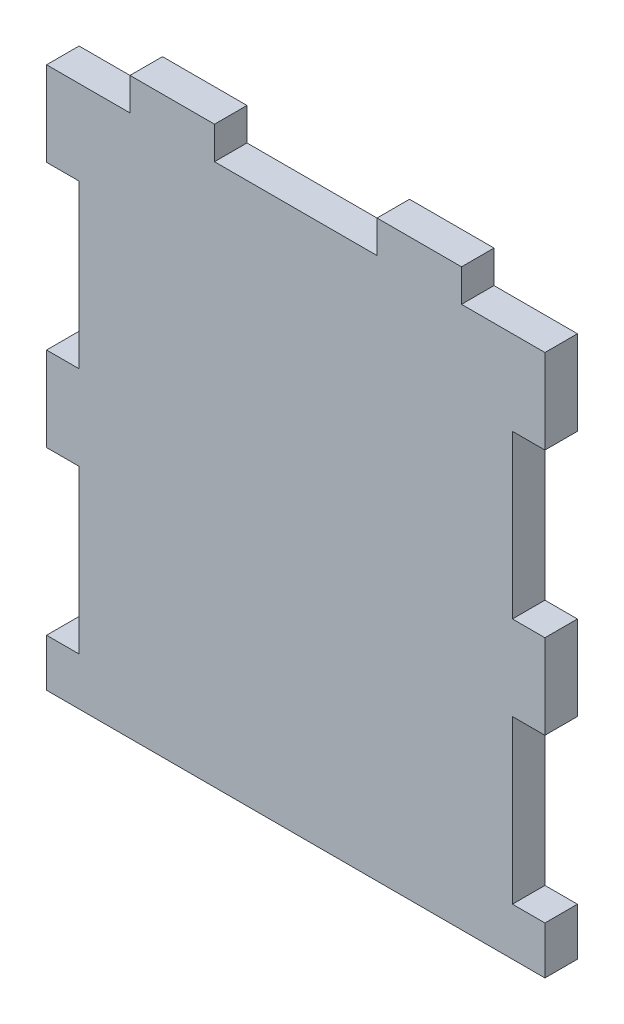
from build123d import *

# Parameters (mm, degrees)
SKETCH1_W           = 46
SKETCH1_H           = 50
BOSS_EXTRUDE1_DEPTH = 3
SKETCH2_W           = 3
SKETCH2_H           = 15
CUT_EXTRUDE1_DEPTH  = 53.999062732
LPATTERN1_COUNT     = 3
LPATTERN1_PITCH     = 22.8
SKETCH3_W           = 7.8
SKETCH3_H           = 3
BOSS_EXTRUDE2_DEPTH = 3
LPATTERN2_COUNT     = 2
LPATTERN2_PITCH     = 22.8


with BuildPart() as part:
    # Sketch1 → Boss-Extrude1 (new body)
    with BuildSketch(Plane.XY):
        with Locations((-17.993460648, -8.457986111)):
            Rectangle(SKETCH1_W, SKETCH1_H)
    extrude(amount=BOSS_EXTRUDE1_DEPTH)

    # Sketch2 → Cut-Extrude1 (cut, through all)
    with BuildSketch(Plane.XY.offset(3)):
        with Locations((-39.493460648, 1.242013889)):
            Rectangle(SKETCH2_W, SKETCH2_H)
        with Locations((3.506539352, 1.242013889)):
            Rectangle(SKETCH2_W, SKETCH2_H)
    cut_extrude1 = extrude(amount=-CUT_EXTRUDE1_DEPTH, mode=Mode.SUBTRACT)

    # LPattern1: Cut-Extrude1 ×3
    with Locations(*[(0, -i * LPATTERN1_PITCH, 0) for i in range(1, LPATTERN1_COUNT)]):
        add(cut_extrude1, mode=Mode.SUBTRACT)

    # Sketch3 → Boss-Extrude2 (add)
    with BuildSketch(Plane(origin=(0, 16.542013889, 0), x_dir=(1, 0, 0), z_dir=(0, 1, 0))):
        with Locations((-29.393460648, -1.5)):
            Rectangle(SKETCH3_W, SKETCH3_H)
    boss_extrude2 = extrude(amount=BOSS_EXTRUDE2_DEPTH)

    # LPattern2: Boss-Extrude2 ×2
    with Locations(*[(i * LPATTERN2_PITCH, 0, 0) for i in range(1, LPATTERN2_COUNT)]):
        add(boss_extrude2)


solid = part.part
